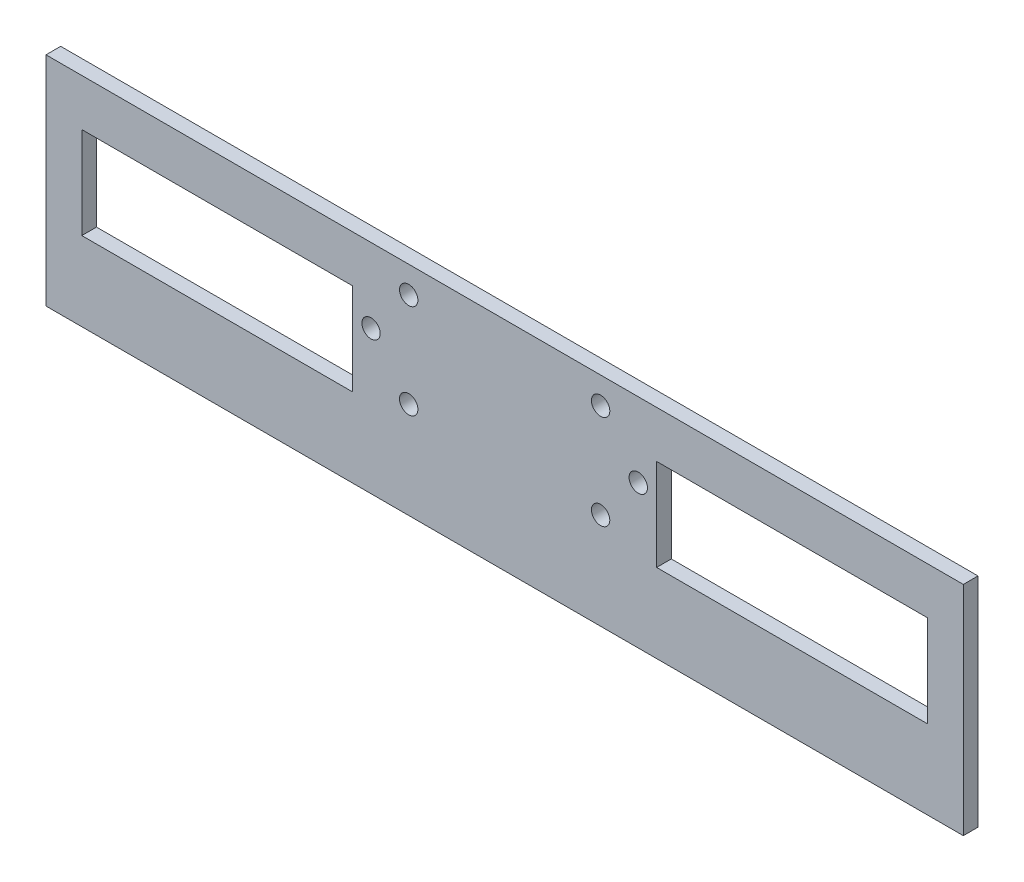
from build123d import *

# Parameters (mm, degrees)
SKETCH_1_W      = 99.9
SKETCH_1_H      = 23.7
SKETCH_1_R      = 1
SKETCH_1_W_2    = 29.5
SKETCH_1_H_2    = 10
EXTRUDE_1_DEPTH = 1.6


with BuildPart() as part:
    # 草图1 → 凸台-拉伸1 (new body)
    with BuildSketch(Plane.XY):
        with Locations((49.95, -11.85)):
            Rectangle(SKETCH_1_W, SKETCH_1_H)
        with Locations((39.5, -2.9)):
            Circle(SKETCH_1_R, mode=Mode.SUBTRACT)
        with Locations((35.4, -8.1)):
            Circle(SKETCH_1_R, mode=Mode.SUBTRACT)
        with Locations((39.5, -13.2)):
            Circle(SKETCH_1_R, mode=Mode.SUBTRACT)
        with Locations(Location((60.4, -2.9, 0), (0, 0, 180))):
            Circle(SKETCH_1_R, mode=Mode.SUBTRACT)
        with Locations(Location((64.5, -8.1, 0), (0, 0, 180))):
            Circle(SKETCH_1_R, mode=Mode.SUBTRACT)
        with Locations(Location((60.4, -13.2, 0), (0, 0, 180))):
            Circle(SKETCH_1_R, mode=Mode.SUBTRACT)
        with Locations((18.65, -10.1)):
            Rectangle(SKETCH_1_W_2, SKETCH_1_H_2, mode=Mode.SUBTRACT)
        with Locations((81.25, -10.1)):
            Rectangle(SKETCH_1_W_2, SKETCH_1_H_2, mode=Mode.SUBTRACT)
    extrude(amount=EXTRUDE_1_DEPTH)


solid = part.part
